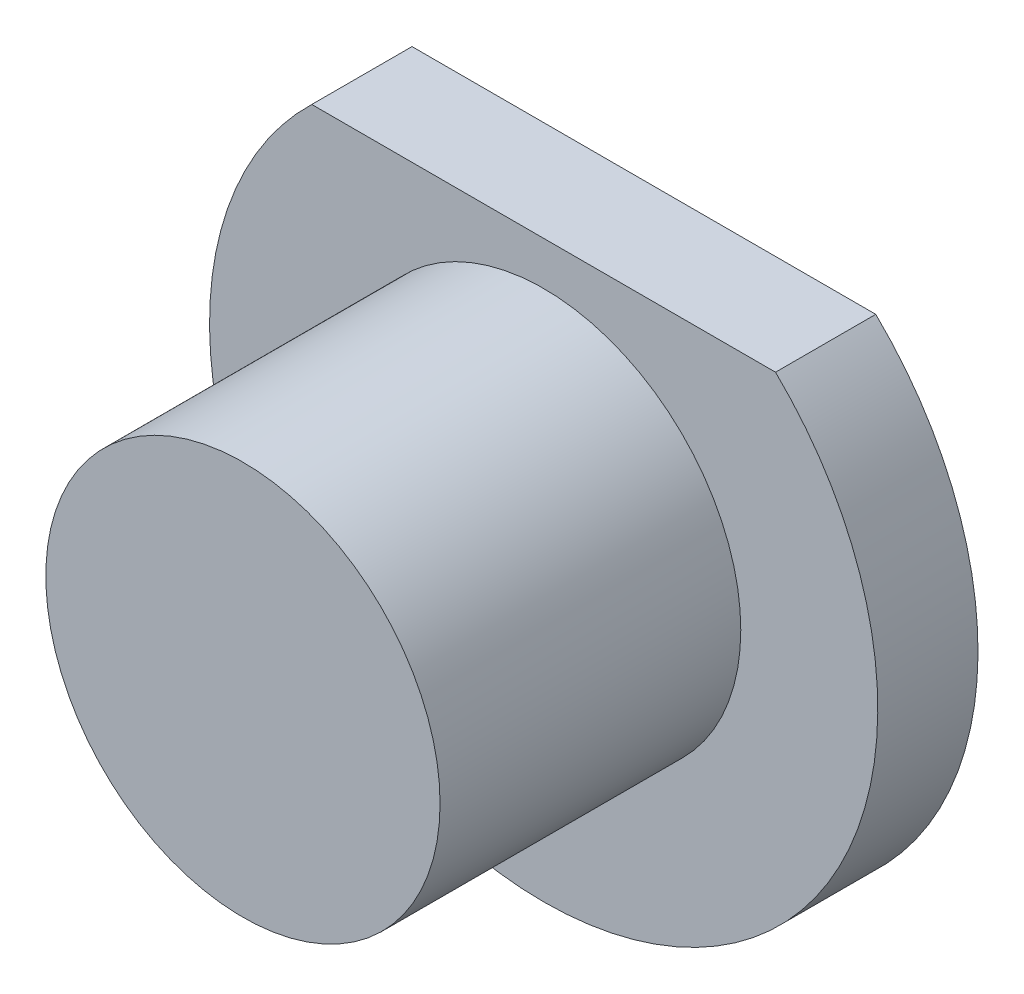
from build123d import *

# Parameters (mm, degrees)
SKETCH1_R           = 2.95
BOSS_EXTRUDE1_DEPTH = 4.5
SKETCH1_5_R         = 2.95
BOSS_EXTRUDE2_DEPTH = 1.5
BOSS_EXTRUDE3_START = 1.5
SKETCH3_R           = 2.95
BOSS_EXTRUDE3_DEPTH = 1.5


with BuildPart() as part:
    # Sketch1 → Boss-Extrude1 (new body)
    with BuildSketch(Plane.XY):
        Circle(SKETCH1_R)
    extrude(amount=BOSS_EXTRUDE1_DEPTH)


with BuildPart() as body_2:
    # Sketch1<5> → Boss-Extrude2 (new body)
    with BuildSketch(Plane.XY):
        with BuildLine():
            Line((-3.469870315, 3.6), (3.469870315, 3.6))
            ThreePointArc((3.469870315, 3.6), (0, -5), (-3.469870315, 3.6))
        make_face()
        Circle(SKETCH1_5_R, mode=Mode.SUBTRACT)
    extrude(amount=-BOSS_EXTRUDE2_DEPTH)


with BuildPart() as boss_extrude3_tool:
    # Sketch3 → Boss-Extrude3 (new body)
    with BuildSketch(Plane(origin=(0, 0, 0), x_dir=(-1, 0, 0), z_dir=(0, 0, -1)).offset(BOSS_EXTRUDE3_START)):
        Circle(SKETCH3_R)
    extrude(amount=-BOSS_EXTRUDE3_DEPTH)


with BuildPart() as part_1:
    add(part.part)


with BuildPart() as part_2:
    # Boss-Extrude3: joined with boss_extrude3_tool
    add(part_1.part.fuse(boss_extrude3_tool.part, body_2.part, tol=0.00001))


solid = part_2.part
